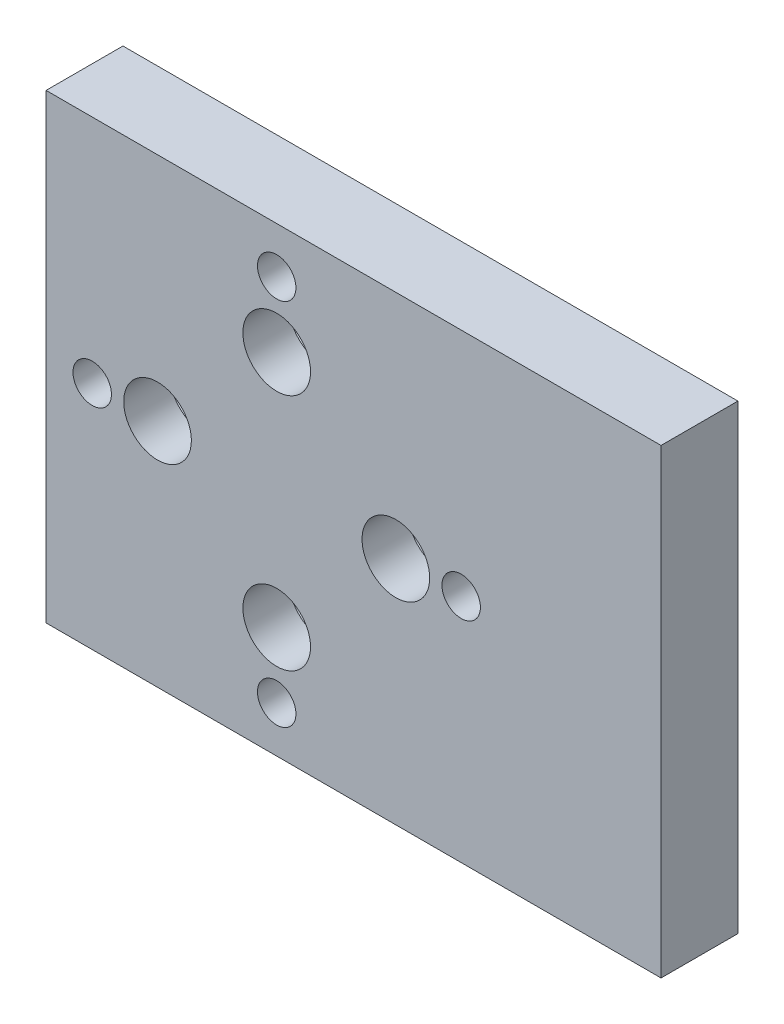
from build123d import *

# Parameters (mm, degrees)
SKETCH_1_W                  = 80
SKETCH_1_H                  = 60
EXTRUDE_1_DEPTH             = 10
HOLE_WIZARD_M5_1_D          = 4.2
HOLE_WIZARD_8_8_8_8_1_D     = 8.8
HOLE_WIZARD_8_8_8_8_1_DEPTH = 6
HOLE_WIZARD_8_8_8_8_1_TIP   = 2.643786724
HOLE_WIZARD_M6_1_D          = 5
HOLE_WIZARD_M6_1_DEPTH      = 5
HOLE_WIZARD_M6_1_TIP        = 1.502151548


with BuildPart() as part:
    # 스케치1 → 보스-돌출1 (new body)
    with BuildSketch(Plane.XY):
        Rectangle(SKETCH_1_W, SKETCH_1_H)
    extrude(amount=EXTRUDE_1_DEPTH)

    # M5 탭을 위한 탭 드릴1 (through all)
    with Locations(Plane(origin=(-25.5, 0, 10), x_dir=(1, 0, 0), z_dir=(0, 0, 1))):
        with Locations((0, 0), (15.5, -15.5), (31, 0), (15.5, 15.5)):
            Hole(HOLE_WIZARD_M5_1_D / 2)

    # Ø8.8 (8.8) 지름 구멍1
    with Locations(Plane(origin=(-25.5, 0, 10), x_dir=(1, 0, 0), z_dir=(0, 0, 1))):
        with Locations((0, 0), (15.5, 15.5), (31, 0), (15.5, -15.5)):
            Hole(HOLE_WIZARD_8_8_8_8_1_D / 2, depth=HOLE_WIZARD_8_8_8_8_1_DEPTH)
            with Locations((0, 0, -(HOLE_WIZARD_8_8_8_8_1_DEPTH + HOLE_WIZARD_8_8_8_8_1_TIP / 2))):  # 118° drill point
                Cone(0, HOLE_WIZARD_8_8_8_8_1_D / 2, HOLE_WIZARD_8_8_8_8_1_TIP, mode=Mode.SUBTRACT)

    # M6 탭을 위한 탭 드릴1
    with Locations(Plane(origin=(-10, 24, 10), x_dir=(1, 0, 0), z_dir=(0, 0, 1))):
        with Locations((0, 0), (-24, -24), (0, -48), (24, -24)):
            Hole(HOLE_WIZARD_M6_1_D / 2, depth=HOLE_WIZARD_M6_1_DEPTH)
            with Locations((0, 0, -(HOLE_WIZARD_M6_1_DEPTH + HOLE_WIZARD_M6_1_TIP / 2))):  # 118° drill point
                Cone(0, HOLE_WIZARD_M6_1_D / 2, HOLE_WIZARD_M6_1_TIP, mode=Mode.SUBTRACT)


solid = part.part
